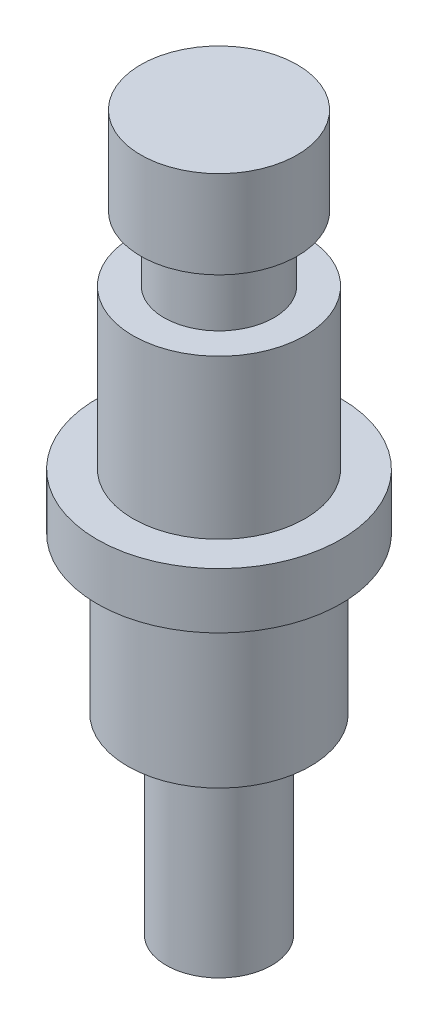
from build123d import *

# Parameters (mm, degrees)
SKETCH1_R           = 4.77
BOSS_EXTRUDE1_DEPTH = 2.18
SKETCH2_R           = 3.575
BOSS_EXTRUDE2_DEPTH = 6.1
SKETCH3_R           = 2.065
BOSS_EXTRUDE3_DEPTH = 7.5
SKETCH4_R           = 3.365
BOSS_EXTRUDE4_DEPTH = 6.2
SKETCH5_R           = 2.15
BOSS_EXTRUDE5_DEPTH = 2.54
SKETCH6_R           = 3.06
BOSS_EXTRUDE6_DEPTH = 3.43


with BuildPart() as part:
    # Sketch1 → Boss-Extrude1 (new body)
    with BuildSketch(Plane(origin=(0, 0, 0), x_dir=(1, 0, 0), z_dir=(0, 1, 0))):
        with Locations(Location((0, 0, 0), (0, 0, 270))):
            Circle(SKETCH1_R)
    extrude(amount=BOSS_EXTRUDE1_DEPTH)

    # Sketch2 → Boss-Extrude2 (add)
    with BuildSketch(Plane.XZ):
        with Locations(Location((0, 0, 0), (0, 0, 90))):
            Circle(SKETCH2_R)
    extrude(amount=BOSS_EXTRUDE2_DEPTH)

    # Sketch3 → Boss-Extrude3 (add)
    with BuildSketch(Plane.XZ.offset(6.1)):
        with Locations(Location((0, 0, 0), (0, 0, 270))):
            Circle(SKETCH3_R)
    extrude(amount=BOSS_EXTRUDE3_DEPTH)

    # Sketch4 → Boss-Extrude4 (add)
    with BuildSketch(Plane(origin=(0, 2.18, 0), x_dir=(1, 0, 0), z_dir=(0, 1, 0))):
        with Locations(Location((0, 0, 0), (0, 0, 90))):
            Circle(SKETCH4_R)
    extrude(amount=BOSS_EXTRUDE4_DEPTH)

    # Sketch5 → Boss-Extrude5 (add)
    with BuildSketch(Plane(origin=(0, 8.38, 0), x_dir=(1, 0, 0), z_dir=(0, 1, 0))):
        with Locations(Location((0, 0, 0), (0, 0, 270))):
            Circle(SKETCH5_R)
    extrude(amount=BOSS_EXTRUDE5_DEPTH)

    # Sketch6 → Boss-Extrude6 (add)
    with BuildSketch(Plane(origin=(0, 10.92, 0), x_dir=(1, 0, 0), z_dir=(0, 1, 0))):
        with Locations(Location((0, 0, 0), (0, 0, 90))):
            Circle(SKETCH6_R)
    extrude(amount=BOSS_EXTRUDE6_DEPTH)


solid = part.part
